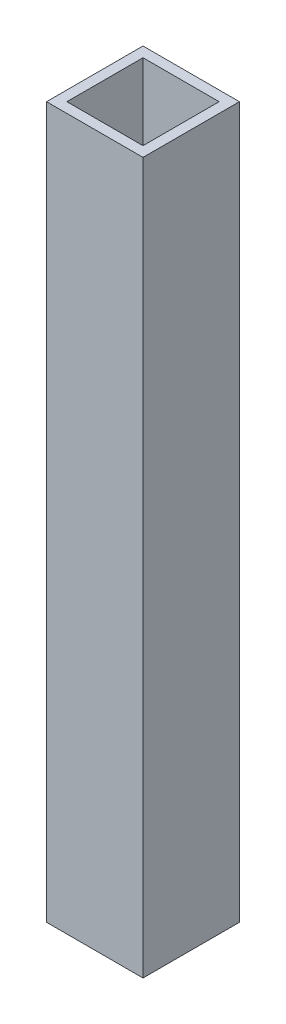
from build123d import *

# Parameters (mm, degrees)
SKETCH1_W           = 19
SKETCH1_H           = 19
SKETCH1_W_2         = 15
SKETCH1_H_2         = 15
EXTRUDE_THIN1_DEPTH = 140


with BuildPart() as part:
    # Sketch1 → Extrude-Thin1 (new body)
    with BuildSketch(Plane(origin=(0, 0, 0), x_dir=(1, 0, 0), z_dir=(0, 1, 0))):
        Rectangle(SKETCH1_W, SKETCH1_H)
        Rectangle(SKETCH1_W_2, SKETCH1_H_2, mode=Mode.SUBTRACT)
    extrude(amount=EXTRUDE_THIN1_DEPTH)


solid = part.part
